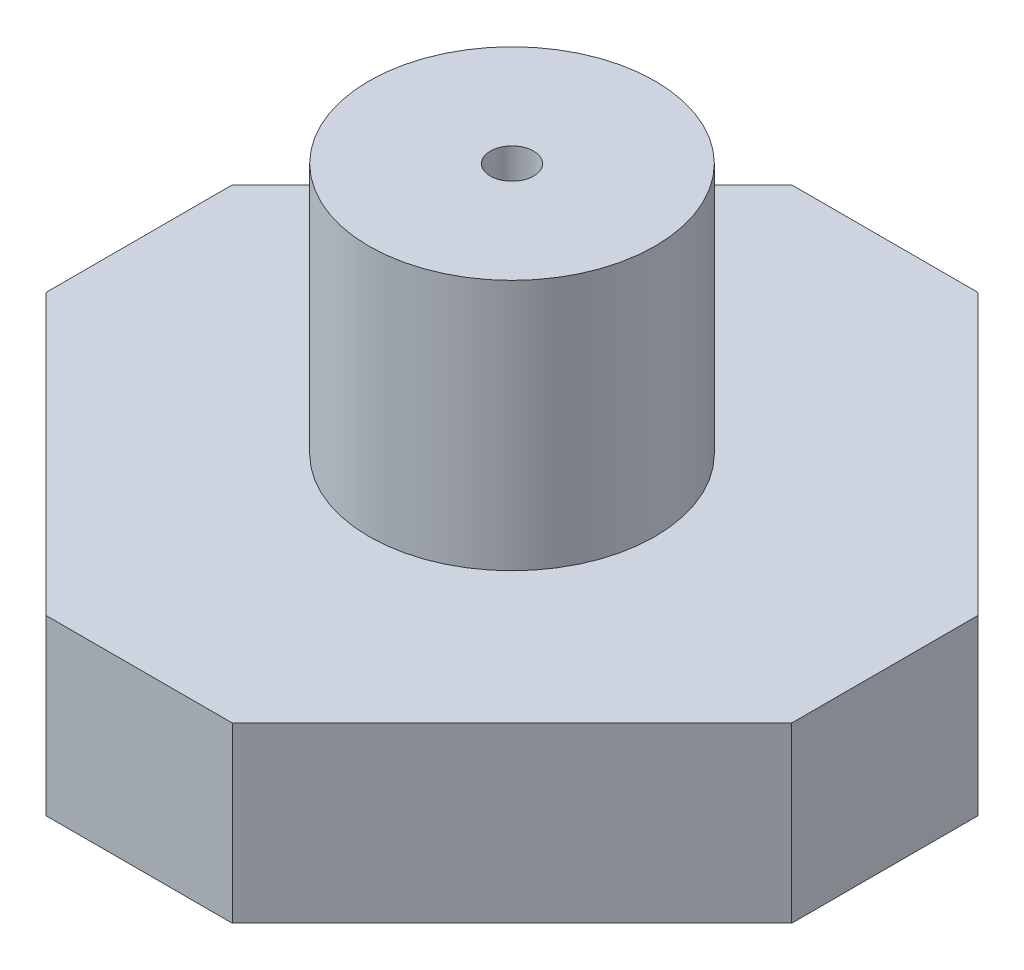
from build123d import *

# Parameters (mm, degrees)
EXTRUDE_1_DEPTH     = 2
SKETCH_2_R          = 1.65
EXTRUDE_2_DEPTH     = 2.9
SKETCH_3_R          = 0.25
CUT_EXTRUDE_1_DEPTH = 10


with BuildPart() as part:
    # 草图1 → 凸台-拉伸1 (new body)
    with BuildSketch(Plane(origin=(0, 0, 0), x_dir=(1, 0, 0), z_dir=(0, 1, 0))):
        Polygon((-4.3, -1.074011537), (-1.074011537, -4.3), (1.074011537, -4.3), (4.3, -1.074011537), (4.3, 1.074011537), (1.074011537, 4.3), (-1.074011537, 4.3), (-4.3, 1.074011537), align=None)
    extrude(amount=EXTRUDE_1_DEPTH)

    # 草图2 → 凸台-拉伸2 (add)
    with BuildSketch(Plane(origin=(0, 2, 0), x_dir=(1, 0, 0), z_dir=(0, 1, 0))):
        with Locations(Location((0, 0, 0), (0, 0, 270))):
            Circle(SKETCH_2_R)
    extrude(amount=EXTRUDE_2_DEPTH)

    # 草图3 → 切除-拉伸1 (cut)
    with BuildSketch(Plane.XZ):
        with Locations(Location((0, 0, 0), (0, 0, 270))):
            Circle(SKETCH_3_R)
    extrude(amount=-CUT_EXTRUDE_1_DEPTH, mode=Mode.SUBTRACT)


solid = part.part
